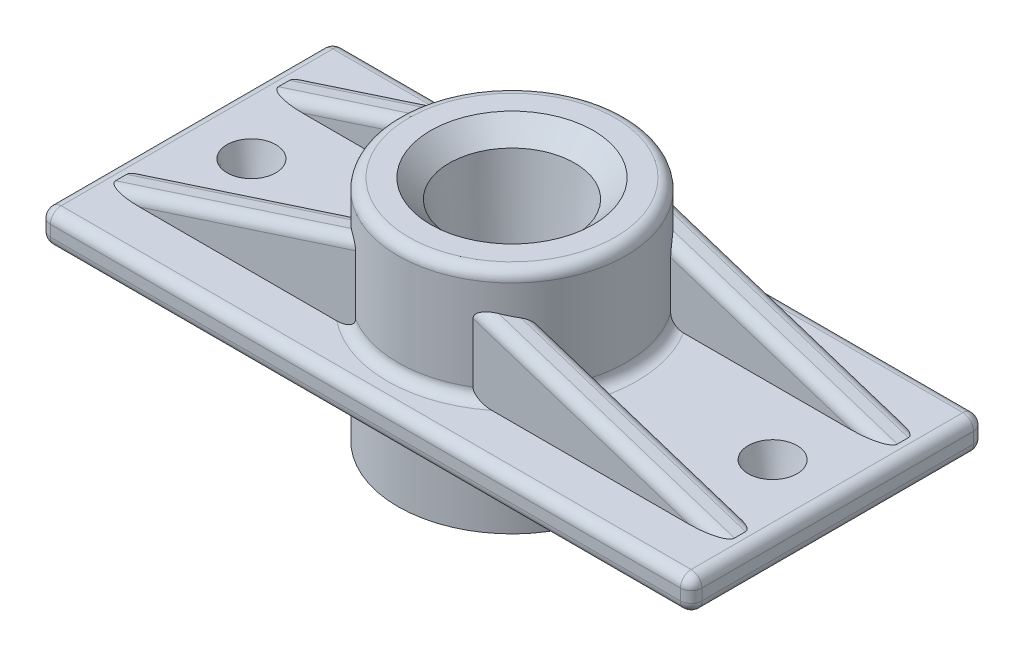
from build123d import *

# Parameters (mm, degrees)
SKETCH1_W                = 127
SKETCH1_H                = 57.15
BOSS_EXTRUDE1_DEPTH      = 6.35
BOSS_EXTRUDE2_DEPTH      = 22.225
BOSS_EXTRUDE2_DEPTH_BACK = 22.225
SKETCH3_R                = 22.225
SKETCH4_R                = 12.7
CUT_EXTRUDE2_DEPTH       = 83.611035128
CUT_EXTRUDE2_DRAFT       = -7.5
BOSS_EXTRUDE3_DEPTH      = 6.35
CHAMFER1_SIZE            = 3.175
CHAMFER1_SIZE2           = 3.687920954
FILLET1_R                = 2.0955


with BuildPart() as part:
    # Sketch1 → Boss-Extrude1 (new body)
    with BuildSketch(Plane(origin=(0, 0, 0), x_dir=(1, 0, 0), z_dir=(0, 1, 0))):
        Rectangle(SKETCH1_W, SKETCH1_H)
    extrude(amount=BOSS_EXTRUDE1_DEPTH)

    # Cut-Extrude1 cone 1 section (through the dimple's axis) → Cut-Extrude1 (revolve, cut)
    with BuildSketch(Plane(origin=(-50.8, 6.35, 0), x_dir=(0, 0, 1), z_dir=(1, 0, 0))):
        Polygon((0, 0), (4.7625, 0), (0, 17.773891971), align=None)
    revolve(axis=Axis((-50.8, 6.35, 0), (0, -1, 0)), mode=Mode.SUBTRACT)

    # Cut-Extrude1 cone 2 section (through the dimple's axis) → Cut-Extrude1 cone 2 (revolve, cut)
    with BuildSketch(Plane(origin=(50.8, 6.35, 0), x_dir=(0, 0, 1), z_dir=(1, 0, 0))):
        Polygon((0, 0), (4.7625, 0), (0, 17.773891971), align=None)
    revolve(axis=Axis((50.8, 6.35, 0), (0, -1, 0)), mode=Mode.SUBTRACT)

    # Sketch3 → Boss-Extrude2 (add, two sides: drawn at the far end of the back side and taken through both)
    with BuildSketch(Plane(origin=(0, 6.35, 0), x_dir=(1, 0, 0), z_dir=(0, 1, 0)).offset(-BOSS_EXTRUDE2_DEPTH_BACK)):
        with Locations(Location((0, 0, 0), (0, 0, 270))):
            Circle(SKETCH3_R)
    extrude(amount=BOSS_EXTRUDE2_DEPTH + BOSS_EXTRUDE2_DEPTH_BACK)


with BuildPart() as cut_extrude2_tool:
    # Sketch4 → Cut-Extrude2 (with draft: the straight prism first)
    with BuildSketch(Plane(origin=(0, 28.575, 0), x_dir=(1, 0, 0), z_dir=(0, 1, 0))):
        Circle(SKETCH4_R)
    extrude(amount=-CUT_EXTRUDE2_DEPTH)
    # Cut-Extrude2: the draft: its side faces are tilted about the plane it starts from
    cut_extrude2_sides = [cut_extrude2_tool.faces().sort_by_distance(p)[0] for p in [
        (-12.7, -13.230517564, 0),
    ]]
    draft(cut_extrude2_sides, Plane(origin=(0, 28.575, 0), x_dir=(1, 0, 0), z_dir=(0, 1, 0)), CUT_EXTRUDE2_DRAFT)


with BuildPart() as part_1:
    add(part.part)

    # Cut-Extrude2: cut by cut_extrude2_tool
    add(cut_extrude2_tool.part, mode=Mode.SUBTRACT)

    # Sketch5 → Boss-Extrude3 (add)
    with BuildSketch(Plane.XY.offset(19.05)):
        Polygon((11.43, 22.225), (11.43, 6.35), (60.325, 6.35), align=None)
        Polygon((-11.43, 22.225), (-11.43, 6.35), (-60.325, 6.35), align=None)
    boss_extrude3 = extrude(amount=-BOSS_EXTRUDE3_DEPTH)

    # Mirror1: Boss-Extrude3 across plane
    add(boss_extrude3.mirror(Plane.XY))

    # Chamfer1
    chamfer1_edges = [part_1.edges().sort_by_distance(p)[0] for p in [
        (-12.7, 28.575, 0),
    ]]
    chamfer1_side = [part_1.faces().sort_by_distance(p)[0] for p in [
        (0, 28.575, -21.596382072),
    ]]
    chamfer(chamfer1_edges, length=CHAMFER1_SIZE, length2=CHAMFER1_SIZE2, reference=chamfer1_side[0])

    # Fillet1
    fillet1_edges = [part_1.edges().sort_by_distance(p)[0] for p in [
        (35.88631265, 14.28463875, 19.05),
        (39.281993201, 13.182145064, 12.7),
        (35.88631265, 14.28463875, -19.05),
        (39.281993201, 13.182145064, -12.7),
        (-39.281993201, 13.182145064, 12.7),
        (-35.88631265, 14.28463875, 19.05),
        (-39.281993201, 13.182145064, -12.7),
        (-35.88631265, 14.28463875, -19.05),
        (-22.225, 6.35, 0),
        (5.939881102, 6.35, 21.416545882),
        (22.225, 6.35, 0),
        (0, 6.35, -22.225),
        (-63.5, 6.35, 0),
        (-63.5, 0, 0),
        (0, 6.35, -28.575),
        (-63.5, 3.175, -28.575),
        (0, 0, -28.575),
        (63.5, 6.35, 0),
        (63.5, 3.175, -28.575),
        (63.5, 0, 0),
        (-63.5, 3.175, 28.575),
        (0, 6.35, 28.575),
        (63.5, 3.175, 28.575),
        (0, 0, 28.575),
        (0, 28.575, -22.225),
    ]]
    fillet(fillet1_edges, radius=FILLET1_R)


solid = part_1.part
